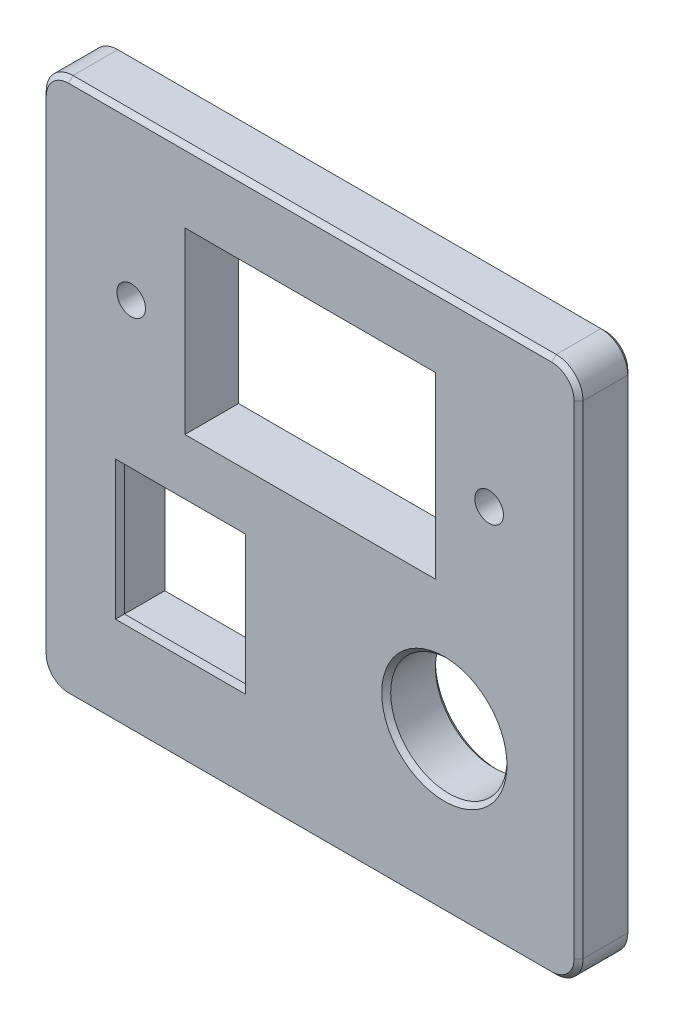
from build123d import *

# Parameters (mm, degrees)
BOSS_EXTRUDE1_DEPTH = 6
SKETCH2_R           = 1.6
SKETCH2_R_2         = 6.5
SKETCH2_W           = 28
SKETCH2_H           = 20
CUT_EXTRUDE1_DEPTH  = 43.848570571
CUT_EXTRUDE2_START  = -1
SKETCH3_W           = 22.5
SKETCH3_H           = 16.5
CUT_EXTRUDE2_DEPTH  = 42.848570571
SKETCH4_W           = 14.5
SKETCH4_H           = 15.5
CUT_EXTRUDE3_DEPTH  = 43.720018727
CUT_EXTRUDE4_DEPTH  = 3
SKETCH6_W           = 5.6
SKETCH6_H           = 3.2
CUT_EXTRUDE5_DEPTH  = 0.4
SKETCH7_R           = 1.3
CUT_EXTRUDE6_DEPTH  = 5
CHAMFER2_SIZE       = 0.5


with BuildPart() as part:
    # Sketch1 → Boss-Extrude1 (new body)
    with BuildSketch(Plane.XY):
        with BuildLine():
            Line((-27, 30), (27, 30))
            ThreePointArc((27, 30), (29.121320344, 29.121320344), (30, 27))
            Line((30, 27), (30, -27))
            ThreePointArc((30, -27), (29.121320344, -29.121320344), (27, -30))
            Line((27, -30), (-27, -30))
            ThreePointArc((-27, -30), (-29.121320344, -29.121320344), (-30, -27))
            Line((-30, -27), (-30, 27))
            ThreePointArc((-30, 27), (-29.121320344, 29.121320344), (-27, 30))
        make_face()
    extrude(amount=BOSS_EXTRUDE1_DEPTH)

    # Sketch2 → Cut-Extrude1 (cut, through all)
    with BuildSketch(Plane.XY.offset(6)):
        with Locations((-20, 12)):
            Circle(SKETCH2_R)
        with Locations((20, 12)):
            Circle(SKETCH2_R)
        with Locations((15, -12)):
            Circle(SKETCH2_R_2)
        with Locations((0, 12)):
            Rectangle(SKETCH2_W, SKETCH2_H)
    extrude(amount=-CUT_EXTRUDE1_DEPTH, mode=Mode.SUBTRACT)

    # Sketch3 → Cut-Extrude2 (cut, through all)
    with BuildSketch(Plane.XY.offset(6).offset(CUT_EXTRUDE2_START)):
        with Locations((-11, -12)):
            Rectangle(SKETCH3_W, SKETCH3_H)
    extrude(amount=-CUT_EXTRUDE2_DEPTH, mode=Mode.SUBTRACT)

    # Sketch4 → Cut-Extrude3 (cut, through all)
    with BuildSketch(Plane(origin=(0, 0, 5), x_dir=(-1, 0, 0), z_dir=(0, 0, -1))):
        with Locations((14.5, -12)):
            Rectangle(SKETCH4_W, SKETCH4_H)
    extrude(amount=-CUT_EXTRUDE3_DEPTH, mode=Mode.SUBTRACT)

    # Sketch5 → Cut-Extrude4 (cut)
    with BuildSketch(Plane.XY):
        Polygon((-20, 8.766838493), (-17.2, 10.383419246), (-17.2, 13.616580754), (-20, 15.233161507), (-22.8, 13.616580754), (-22.8, 10.383419246), align=None)
        Polygon((20, 8.766838493), (22.8, 10.383419246), (22.8, 13.616580754), (20, 15.233161507), (17.2, 13.616580754), (17.2, 10.383419246), align=None)
    extrude(amount=CUT_EXTRUDE4_DEPTH, mode=Mode.SUBTRACT)

    # Sketch6 → Cut-Extrude5 (cut)
    with BuildSketch(Plane(origin=(0, 0, 3), x_dir=(-1, 0, 0), z_dir=(0, 0, -1))):
        with Locations((20, 12)):
            Rectangle(SKETCH6_W, SKETCH6_H)
        with Locations((-20, 12)):
            Rectangle(SKETCH6_W, SKETCH6_H)
    extrude(amount=-CUT_EXTRUDE5_DEPTH, mode=Mode.SUBTRACT)

    # Sketch7 → Cut-Extrude6 (cut)
    with BuildSketch(Plane(origin=(0, 0, 0), x_dir=(-1, 0, 0), z_dir=(0, 0, -1))):
        with Locations((-26, 26)):
            Circle(SKETCH7_R)
        with Locations((26, 26)):
            Circle(SKETCH7_R)
        with Locations((26, -26)):
            Circle(SKETCH7_R)
        with Locations((-26, -26)):
            Circle(SKETCH7_R)
    extrude(amount=-CUT_EXTRUDE6_DEPTH, mode=Mode.SUBTRACT)

    # Chamfer2
    chamfer2_edges = [part.edges().sort_by_distance(p)[0] for p in [
        (-29.121320344, 29.121320344, 6),
        (0, 30, 0),
        (29.121320344, 29.121320344, 0),
        (-30, 0, 6),
        (-29.121320344, -29.121320344, 6),
        (27.3, 26, 0),
        (-24.7, 26, 0),
        (-24.7, -26, 0),
        (27.3, -26, 0),
        (0, -30, 6),
        (29.121320344, -29.121320344, 6),
        (30, 0, 6),
        (29.121320344, 29.121320344, 6),
        (8.5, -12, 0),
        (8.5, -12, 6),
        (0, 30, 6),
        (30, 0, 0),
        (29.121320344, -29.121320344, 0),
        (0, -30, 0),
        (-29.121320344, -29.121320344, 0),
        (-30, 0, 0),
        (-29.121320344, 29.121320344, 0),
    ]]
    chamfer(chamfer2_edges, length=CHAMFER2_SIZE)


solid = part.part
